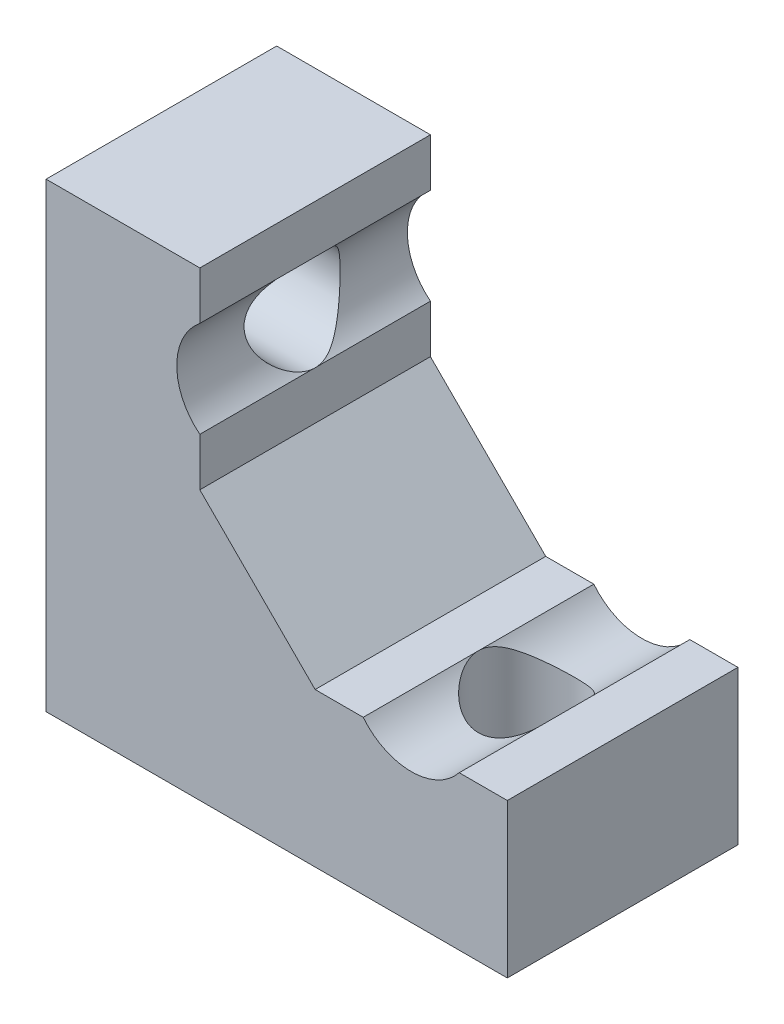
from build123d import *

# Parameters (mm, degrees)
SALIENTE_EXTRUIR1_DEPTH = 6
CROQUIS3_R              = 1.25
CORTAR_EXTRUIR1_DEPTH   = 4
CROQUIS4_R              = 1.25
CORTAR_EXTRUIR2_DEPTH   = 4
CROQUIS5_R              = 1.6
CORTAR_EXTRUIR3_DEPTH   = 6


with BuildPart() as part:
    # Croquis1 → Saliente-Extruir1 (new body)
    with BuildSketch(Plane.XY):
        Polygon((0, 0), (0, 12), (4, 12), (4, 7), (7, 4), (12, 4), (12, 0), align=None)
    extrude(amount=SALIENTE_EXTRUIR1_DEPTH)

    # Croquis3 → Cortar-Extruir1 (cut)
    with BuildSketch(Plane(origin=(0, 4, 0), x_dir=(1, 0, 0), z_dir=(0, 1, 0))):
        with Locations(Location((9.5, -3, 0), (0, 0, 180))):
            Circle(CROQUIS3_R)
    extrude(amount=-CORTAR_EXTRUIR1_DEPTH, mode=Mode.SUBTRACT)

    # Croquis4 → Cortar-Extruir2 (cut)
    with BuildSketch(Plane(origin=(4, 0, 0), x_dir=(0, 0, -1), z_dir=(1, 0, 0))):
        with Locations(Location((-3, 9.5, 0), (0, 0, 90))):
            Circle(CROQUIS4_R)
    extrude(amount=-CORTAR_EXTRUIR2_DEPTH, mode=Mode.SUBTRACT)

    # Croquis5 → Cortar-Extruir3 (cut)
    with BuildSketch(Plane.XY.offset(6)):
        with Locations((9.5, 5)):
            Circle(CROQUIS5_R)
        with Locations((5, 9.5)):
            Circle(CROQUIS5_R)
    extrude(amount=-CORTAR_EXTRUIR3_DEPTH, mode=Mode.SUBTRACT)


solid = part.part
